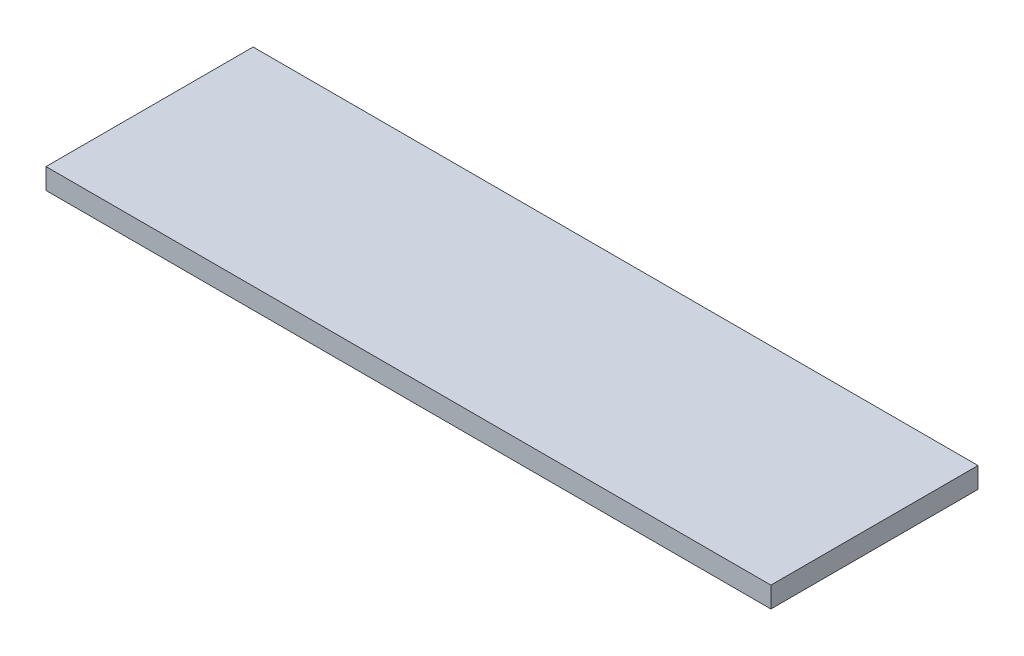
from build123d import *

# Parameters (mm, degrees)
SKETCH1_W           = 70
SKETCH1_H           = 20
BOSS_EXTRUDE1_DEPTH = 2


with BuildPart() as part:
    # Sketch1 → Boss-Extrude1 (new body)
    with BuildSketch(Plane(origin=(0, 0, 0), x_dir=(1, 0, 0), z_dir=(0, 1, 0))):
        with Locations((35, 10)):
            Rectangle(SKETCH1_W, SKETCH1_H)
    extrude(amount=BOSS_EXTRUDE1_DEPTH)


solid = part.part
